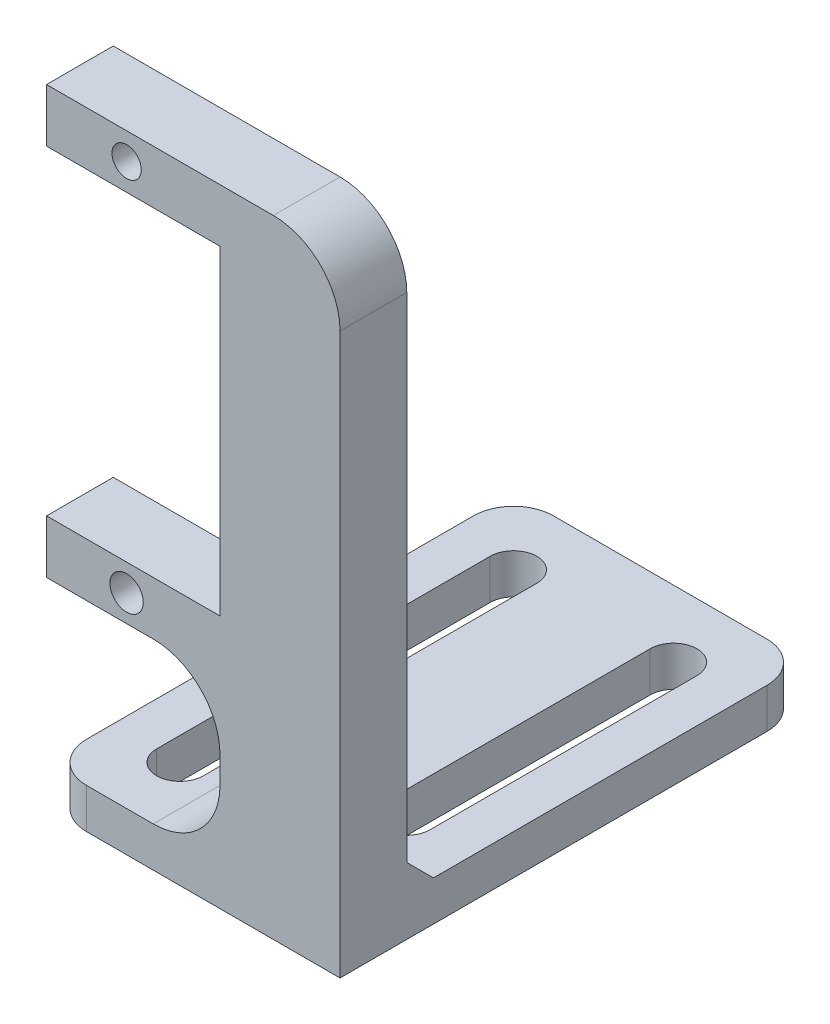
from build123d import *

# Parameters (mm, degrees)
SKETCH_1_R          = 1.1
SKETCH_1_R_2        = 1.25
EXTRUDE_1_DEPTH     = 2.5
EXTRUDE_START       = 2.5
SKETCH_1_5_W        = 22
SKETCH_1_5_H        = 3
EXTRUDE_3_DEPTH     = 35
CUT_EXTRUDE_1_DEPTH = 20
FILLET_1_R          = 5
FILLET_5_R          = 3
CHAMFER_1_SIZE      = 2
FILLET_6_R          = 5


with BuildPart() as part:
    # 草图1 → 凸台-拉伸1 (new, symmetric)
    with BuildSketch(Plane.XY):
        Polygon((-6, 16), (-6, 12), (7, 12), (7, -12), (-6, -12), (-6, -16), (7, -16), (7, -28), (16, -28), (16, 16), align=None)
        with Locations((0, 14)):
            Circle(SKETCH_1_R, mode=Mode.SUBTRACT)
        with Locations((0, -14)):
            Circle(SKETCH_1_R_2, mode=Mode.SUBTRACT)
    extrude(amount=EXTRUDE_1_DEPTH, both=True)

    # 草图1<5> → 凸台-拉伸3 (add)
    with BuildSketch(Plane.XY.offset(EXTRUDE_START)):
        with Locations((5, -29.5)):
            Rectangle(SKETCH_1_5_W, SKETCH_1_5_H)
    extrude(amount=-EXTRUDE_3_DEPTH)

    # 草图2 → 切除-拉伸1 (cut)
    with BuildSketch(Plane(origin=(0, -28, 0), x_dir=(1, 0, 0), z_dir=(0, 1, 0))):
        with BuildLine():
            Line((0.75, 2.5), (0.75, 27.5))
            ThreePointArc((0.75, 27.5), (-1, 29.25), (-2.75, 27.5))
            Line((-2.75, 27.5), (-2.75, 2.5))
            ThreePointArc((-2.75, 2.5), (-1, 0.75), (0.75, 2.5))
        make_face()
        with BuildLine():
            Line((12.75, 7.5), (12.75, 27.5))
            ThreePointArc((12.75, 27.5), (11, 29.25), (9.25, 27.5))
            Line((9.25, 27.5), (9.25, 7.5))
            ThreePointArc((9.25, 7.5), (11, 5.75), (12.75, 7.5))
        make_face()
    extrude(amount=-CUT_EXTRUDE_1_DEPTH, mode=Mode.SUBTRACT)

    # 圆角1
    fillet_1_edges = [part.edges().sort_by_distance(p)[0] for p in [
        (7, -28, 0),
        (7, -16, 0),
    ]]
    fillet(fillet_1_edges, radius=FILLET_1_R)

    # 圆角5
    fillet_5_edges = [part.edges().sort_by_distance(p)[0] for p in [
        (16, -29.5, -32.5),
        (-6, -29.5, 2.5),
        (-6, -29.5, -32.5),
    ]]
    fillet(fillet_5_edges, radius=FILLET_5_R)

    # 倒角1
    chamfer_1_edges = [part.edges().sort_by_distance(p)[0] for p in [
        (9, -28, -2.5),
    ]]
    chamfer(chamfer_1_edges, length=CHAMFER_1_SIZE)

    # 圆角6
    fillet_6_edges = [part.edges().sort_by_distance(p)[0] for p in [
        (16, 16, 0),
    ]]
    fillet(fillet_6_edges, radius=FILLET_6_R)


solid = part.part
